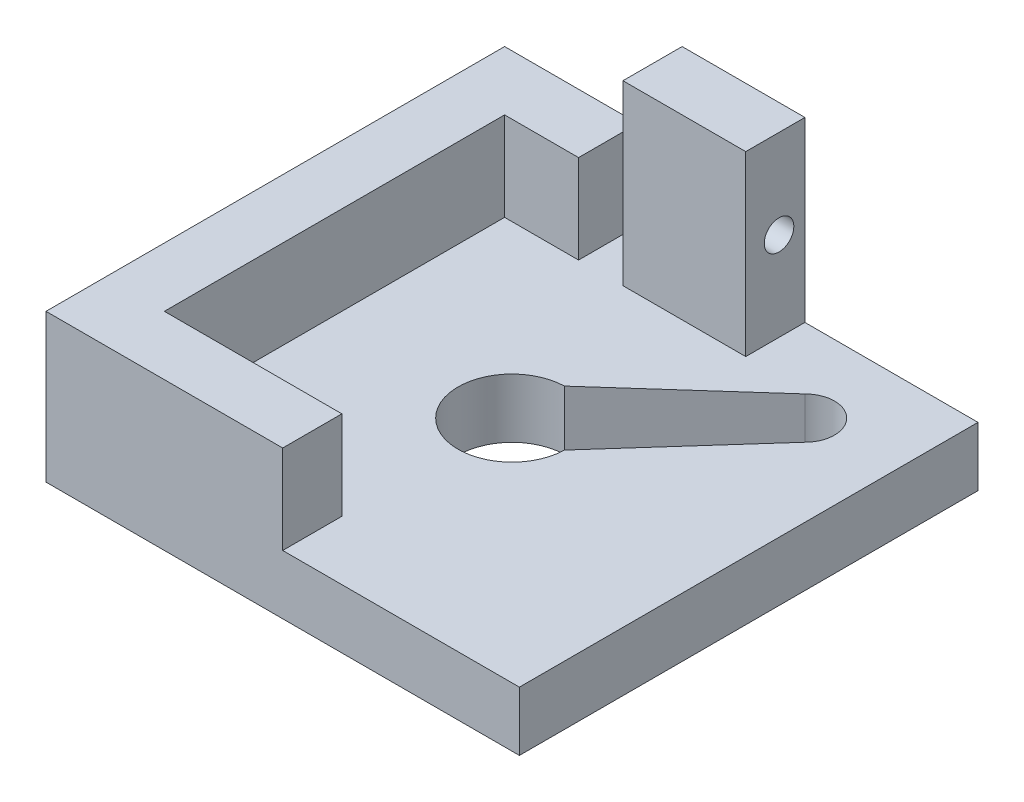
from build123d import *

# Parameters (mm, degrees)
SKETCH1_W           = 32
SKETCH1_H           = 31
BOSS_EXTRUDE1_DEPTH = 4
BOSS_EXTRUDE2_DEPTH = 6
SKETCH5_W           = 8.3
SKETCH5_H           = 4
BOSS_EXTRUDE3_DEPTH = 12
SKETCH6_R           = 1
CUT_EXTRUDE7_DEPTH  = 5
CUT_EXTRUDE6_DEPTH  = 4


with BuildPart() as part:
    # Sketch1 → Boss-Extrude1 (new body)
    with BuildSketch(Plane(origin=(0, 0, 0), x_dir=(1, 0, 0), z_dir=(0, 1, 0))):
        Rectangle(SKETCH1_W, SKETCH1_H)
    extrude(amount=BOSS_EXTRUDE1_DEPTH)

    # Sketch2 → Boss-Extrude2 (add)
    with BuildSketch(Plane(origin=(0, 4, 0), x_dir=(1, 0, 0), z_dir=(0, 1, 0))):
        Polygon((-16, 15.5), (-16, -15.5), (0, -15.5), (0, -11.5), (-12, -11.5), (-12, 11.5), (-7, 11.5), (-7, 15.5), align=None)
    extrude(amount=BOSS_EXTRUDE2_DEPTH)

    # Sketch5 → Boss-Extrude3 (add)
    with BuildSketch(Plane(origin=(0, 4, 0), x_dir=(1, 0, 0), z_dir=(0, 1, 0))):
        with Locations((0.15, 13.5)):
            Rectangle(SKETCH5_W, SKETCH5_H)
    extrude(amount=BOSS_EXTRUDE3_DEPTH)

    # Sketch6 → Cut-Extrude7 (cut)
    with BuildSketch(Plane(origin=(4.3, 0, 0), x_dir=(0, 0, -1), z_dir=(1, 0, 0))):
        with Locations((13.75, 10)):
            Circle(SKETCH6_R)
    extrude(amount=-CUT_EXTRUDE7_DEPTH, mode=Mode.SUBTRACT)

    # Sketch4 → Cut-Extrude6 (cut)
    with BuildSketch(Plane(origin=(0, 4, 0), x_dir=(0.7071067811864886, 0, -0.7071067811866065), z_dir=(0, 1, 0))):
        with BuildLine():
            Line((14, 2), (2.50998008, 2.65))
            ThreePointArc((2.50998008, 2.65), (3.352903763, 1.442406446), (3.65, 0))
            ThreePointArc((3.65, 0), (3.352903763, -1.442406446), (2.50998008, -2.65))
            Line((2.50998008, -2.65), (14, -2))
            ThreePointArc((14, -2), (15.414213562, -1.414213562), (16, 0))
            ThreePointArc((16, 0), (15.414213562, 1.414213562), (14, 2))
        make_face()
        with BuildLine():
            ThreePointArc((3.65, 0), (3.352903763, 1.442406446), (2.50998008, 2.65))
            ThreePointArc((2.50998008, 2.65), (-3.65, 0), (2.50998008, -2.65))
            ThreePointArc((2.50998008, -2.65), (3.352903763, -1.442406446), (3.65, 0))
        make_face()
    extrude(amount=-CUT_EXTRUDE6_DEPTH, mode=Mode.SUBTRACT)


solid = part.part
